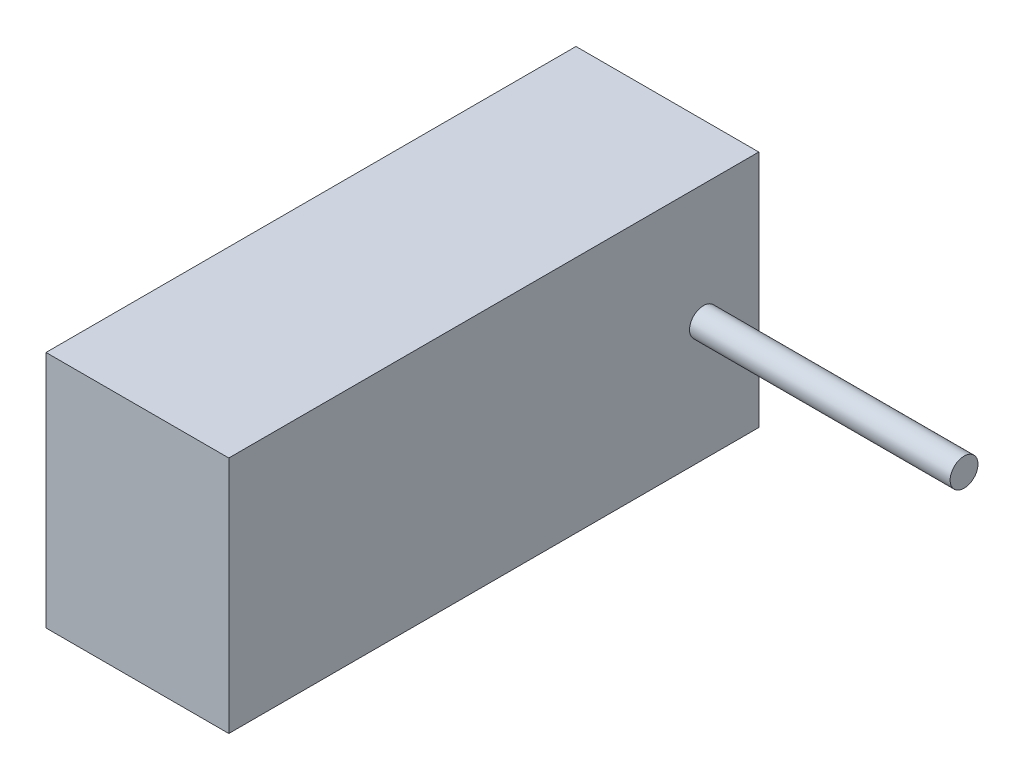
from build123d import *

# Parameters (mm, degrees)
ESQUISSE1_W        = 19.15
ESQUISSE1_H        = 55.52
BOSS_EXTRU_1_DEPTH = 25
ESQUISSE3_R        = 1.46
BOSS_EXTRU_2_DEPTH = 46.45


with BuildPart() as part:
    # Esquisse1 → Boss.-Extru.1 (new body)
    with BuildSketch(Plane(origin=(0, 0, 0), x_dir=(1, 0, 0), z_dir=(0, 1, 0))):
        with Locations((9.575, 27.76)):
            Rectangle(ESQUISSE1_W, ESQUISSE1_H)
    extrude(amount=BOSS_EXTRU_1_DEPTH)

    # Esquisse3 → Boss.-Extru.2 (add)
    with BuildSketch(Plane(origin=(0, 0, 0), x_dir=(0, 0, -1), z_dir=(1, 0, 0))):
        with Locations((49.726650103, 12.5)):
            Circle(ESQUISSE3_R)
    extrude(amount=BOSS_EXTRU_2_DEPTH)


solid = part.part
